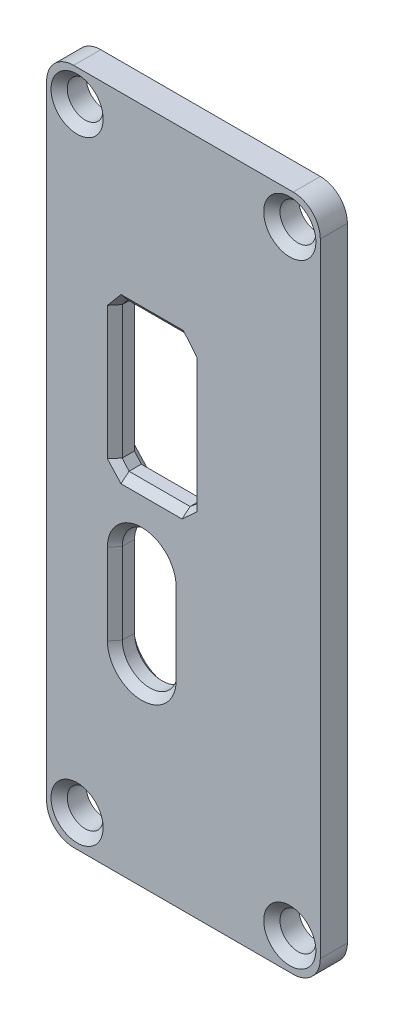
from build123d import *
from OCP.BRepFilletAPI import BRepFilletAPI_MakeChamfer

# Parameters (mm, degrees)
SKETCH_2_W      = 20.2
SKETCH_2_H      = 50
SKETCH_2_R      = 1.325
SKETCH_2_W_2    = 5.6
SKETCH_2_H_2    = 11
EXTRUDE_1_DEPTH = 2
FILLET_1_R      = 2
CHAMFER_1_SIZE  = 0.6
CHAMFER_2_SIZE  = 0.5
CHAMFER_2_SIZE2 = 0.595876796


with BuildPart() as part:
    # 草图2 → 凸台-拉伸1 (new body)
    with BuildSketch(Plane.XY):
        with Locations((6.4, 0)):
            Rectangle(SKETCH_2_W, SKETCH_2_H)
        with Locations((-1.45, -22.65)):
            Circle(SKETCH_2_R, mode=Mode.SUBTRACT)
        with Locations((-1.45, 22.65)):
            Circle(SKETCH_2_R, mode=Mode.SUBTRACT)
        with Locations((14.25, 22.65)):
            Circle(SKETCH_2_R, mode=Mode.SUBTRACT)
        with Locations((14.25, -22.65)):
            Circle(SKETCH_2_R, mode=Mode.SUBTRACT)
        with BuildLine():
            Line((5.361456992, -4.555), (5.361456992, -10.545))
            ThreePointArc((5.361456992, -10.545), (3.325, -12.581456992), (1.288543008, -10.545))
            Line((1.288543008, -10.545), (1.288543008, -4.555))
            ThreePointArc((1.288543008, -4.555), (3.325, -2.518543008), (5.361456992, -4.555))
        make_face(mode=Mode.SUBTRACT)
        with Locations((4.088543008, 6)):
            Rectangle(SKETCH_2_W_2, SKETCH_2_H_2, mode=Mode.SUBTRACT)
    extrude(amount=EXTRUDE_1_DEPTH)

    # 圆角1
    fillet_1_edges = [part.edges().sort_by_distance(p)[0] for p in [
        (-3.7, 25, 1),
        (16.5, 25, 1),
        (16.5, -25, 1),
        (-3.7, -25, 1),
    ]]
    fillet(fillet_1_edges, radius=FILLET_1_R)

    # 倒角1
    chamfer_1_edges = [part.edges().sort_by_distance(p)[0] for p in [
        (-2.775, -22.65, 2),
        (-2.775, 22.65, 2),
        (12.925, 22.65, 2),
        (12.925, -22.65, 2),
    ]]
    chamfer(chamfer_1_edges, length=CHAMFER_1_SIZE)

    # 倒角2: one chamfer whose edges measure the first distance from different faces: ONE call of the kernel's chamfer builder (chamfer() names one face for all edges)
    chamfer_2_edges_1 = [part.edges().sort_by_distance(p)[0] for p in [
        (3.325, -2.518543008, 0),
    ]]
    chamfer_2_side_1 = [part.faces().sort_by_distance(p)[0] for p in [
        (3.325, -2.518543008, 1),
    ]]
    chamfer_2_edges_2 = [part.edges().sort_by_distance(p)[0] for p in [
        (1.288543008, -7.55, 0),
    ]]
    chamfer_2_side_2 = [part.faces().sort_by_distance(p)[0] for p in [
        (1.288543008, -7.55, 1),
    ]]
    chamfer_2_edges_3 = [part.edges().sort_by_distance(p)[0] for p in [
        (3.325, -12.581456992, 0),
    ]]
    chamfer_2_side_3 = [part.faces().sort_by_distance(p)[0] for p in [
        (3.325, -12.581456992, 1),
    ]]
    chamfer_2_edges_4 = [part.edges().sort_by_distance(p)[0] for p in [
        (5.361456992, -7.55, 0),
    ]]
    chamfer_2_side_4 = [part.faces().sort_by_distance(p)[0] for p in [
        (5.361456992, -7.55, 1),
    ]]
    chamfer_2_edges_5 = [part.edges().sort_by_distance(p)[0] for p in [
        (3.325, -2.518543008, 2),
        (1.288543008, -7.55, 2),
        (3.325, -12.581456992, 2),
        (5.361456992, -7.55, 2),
        (1.288543008, 6, 2),
        (4.088543008, 0.5, 2),
        (6.888543008, 6, 2),
    ]]
    chamfer_2_side_5 = [part.faces().sort_by_distance(p)[0] for p in [
        (6.699043587, -0.101092382, 2),
    ]]
    chamfer_2_edges_6 = [part.edges().sort_by_distance(p)[0] for p in [
        (1.288543008, 6, 0),
    ]]
    chamfer_2_side_6 = [part.faces().sort_by_distance(p)[0] for p in [
        (1.288543008, 6, 1),
    ]]
    chamfer_2_edges_7 = [part.edges().sort_by_distance(p)[0] for p in [
        (1.288543008, 11.5, 1),
        (4.088543008, 11.5, 0),
        (6.888543008, 11.5, 1),
        (4.088543008, 11.5, 2),
    ]]
    chamfer_2_side_7 = [part.faces().sort_by_distance(p)[0] for p in [
        (4.088543008, 11.5, 1),
    ]]
    chamfer_2_edges_8 = [part.edges().sort_by_distance(p)[0] for p in [
        (4.088543008, 0.5, 0),
        (1.288543008, 0.5, 1),
    ]]
    chamfer_2_side_8 = [part.faces().sort_by_distance(p)[0] for p in [
        (4.088543008, 0.5, 1),
    ]]
    chamfer_2_edges_9 = [part.edges().sort_by_distance(p)[0] for p in [
        (6.888543008, 6, 0),
        (6.888543008, 0.5, 1),
    ]]
    chamfer_2_side_9 = [part.faces().sort_by_distance(p)[0] for p in [
        (6.888543008, 6, 1),
    ]]
    chamfer_2 = BRepFilletAPI_MakeChamfer(part.part.solid().wrapped)
    for e in chamfer_2_edges_1:
        chamfer_2.Add(CHAMFER_2_SIZE, CHAMFER_2_SIZE2, e.wrapped, chamfer_2_side_1[0].wrapped)  # the first distance lies on this face
    for e in chamfer_2_edges_2:
        chamfer_2.Add(CHAMFER_2_SIZE, CHAMFER_2_SIZE2, e.wrapped, chamfer_2_side_2[0].wrapped)  # the first distance lies on this face
    for e in chamfer_2_edges_3:
        chamfer_2.Add(CHAMFER_2_SIZE, CHAMFER_2_SIZE2, e.wrapped, chamfer_2_side_3[0].wrapped)  # the first distance lies on this face
    for e in chamfer_2_edges_4:
        chamfer_2.Add(CHAMFER_2_SIZE, CHAMFER_2_SIZE2, e.wrapped, chamfer_2_side_4[0].wrapped)  # the first distance lies on this face
    for e in chamfer_2_edges_5:
        chamfer_2.Add(CHAMFER_2_SIZE, CHAMFER_2_SIZE2, e.wrapped, chamfer_2_side_5[0].wrapped)  # the first distance lies on this face
    for e in chamfer_2_edges_6:
        chamfer_2.Add(CHAMFER_2_SIZE, CHAMFER_2_SIZE2, e.wrapped, chamfer_2_side_6[0].wrapped)  # the first distance lies on this face
    for e in chamfer_2_edges_7:
        chamfer_2.Add(CHAMFER_2_SIZE, CHAMFER_2_SIZE2, e.wrapped, chamfer_2_side_7[0].wrapped)  # the first distance lies on this face
    for e in chamfer_2_edges_8:
        chamfer_2.Add(CHAMFER_2_SIZE, CHAMFER_2_SIZE2, e.wrapped, chamfer_2_side_8[0].wrapped)  # the first distance lies on this face
    for e in chamfer_2_edges_9:
        chamfer_2.Add(CHAMFER_2_SIZE, CHAMFER_2_SIZE2, e.wrapped, chamfer_2_side_9[0].wrapped)  # the first distance lies on this face
    add(Compound.cast(chamfer_2.Shape()), mode=Mode.REPLACE)


solid = part.part
